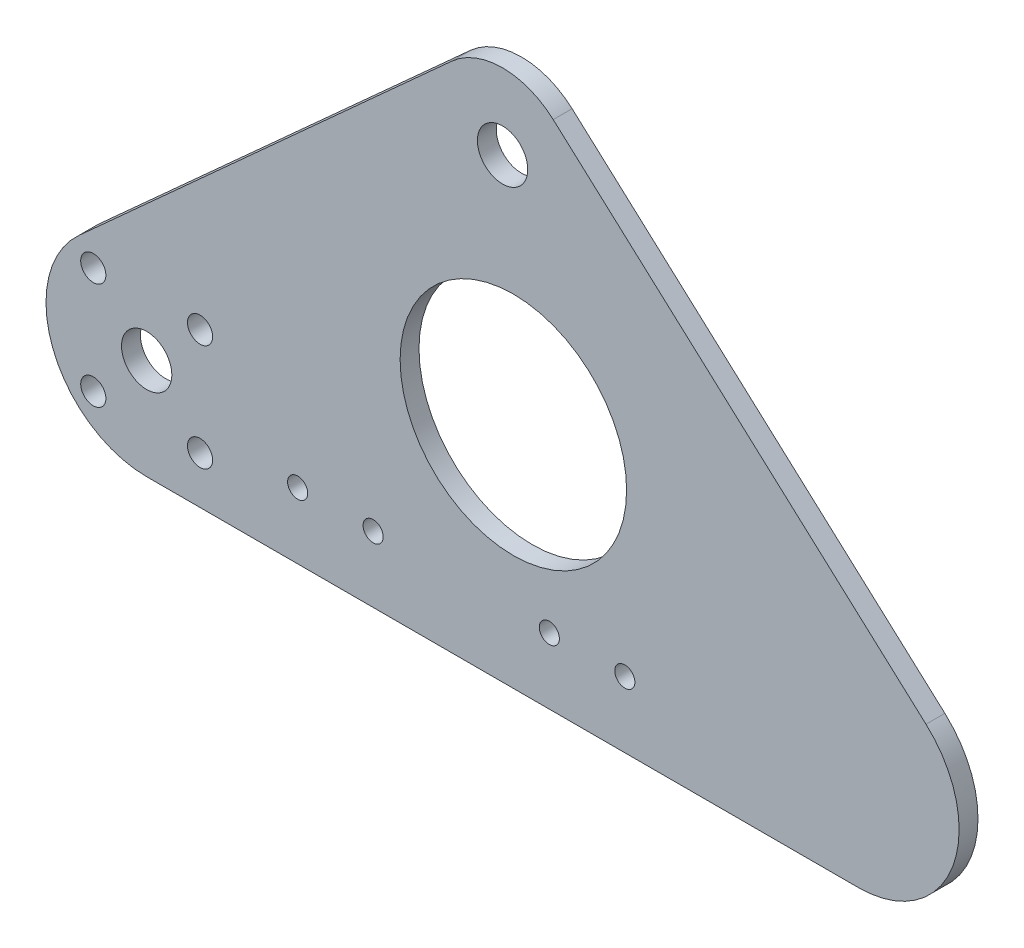
from build123d import *

# Parameters (mm, degrees)
MODEL_R         = 1.6
MODEL_R_2       = 18
MODEL_R_3       = 4
MODEL_R_4       = 2
EXTRUDE_1_DEPTH = 3


with BuildPart() as part:
    # Model → 凸台-拉伸1 (new body)
    with BuildSketch(Plane.XY):
        with BuildLine():
            Line((-69.018143336, -8.419028309), (-9.766132819, 45.183203451))
            ThreePointArc((-9.766132819, 45.183203451), (-1.715728752, 48.284271248), (6.334675314, 45.183203451))
            Line((6.334675314, 45.183203451), (65.586685831, -8.419028309))
            ThreePointArc((65.586685831, -8.419028309), (69.783384512, -26.035623827), (54.852813742, -36.284271247))
            Line((54.852813742, -36.284271247), (-58.284271247, -36.284271247))
            ThreePointArc((-58.284271247, -36.284271247), (-73.214842017, -26.035623827), (-69.018143336, -8.419028309))
        make_face()
        with Locations((5.715728753, -25.784271247)):
            Circle(MODEL_R, mode=Mode.SUBTRACT)
        Circle(MODEL_R_2, mode=Mode.SUBTRACT)
        with Locations((-58.284271248, -20.284271247)):
            Circle(MODEL_R_3, mode=Mode.SUBTRACT)
        with Locations((-1.715728753, 36.284271247)):
            Circle(MODEL_R_3, mode=Mode.SUBTRACT)
        with Locations((-22.284271247, -25.784271247)):
            Circle(MODEL_R, mode=Mode.SUBTRACT)
        with Locations((-34.284271247, -25.784271247)):
            Circle(MODEL_R, mode=Mode.SUBTRACT)
        with Locations((17.715728753, -25.784271247)):
            Circle(MODEL_R, mode=Mode.SUBTRACT)
        with Locations((-66.769552622, -11.798989873)):
            Circle(MODEL_R_4, mode=Mode.SUBTRACT)
        with Locations((-49.798989873, -11.798989873)):
            Circle(MODEL_R_4, mode=Mode.SUBTRACT)
        with Locations((-49.798989873, -28.769552622)):
            Circle(MODEL_R_4, mode=Mode.SUBTRACT)
        with Locations((-66.769552622, -28.769552622)):
            Circle(MODEL_R_4, mode=Mode.SUBTRACT)
    extrude(amount=EXTRUDE_1_DEPTH)


solid = part.part
